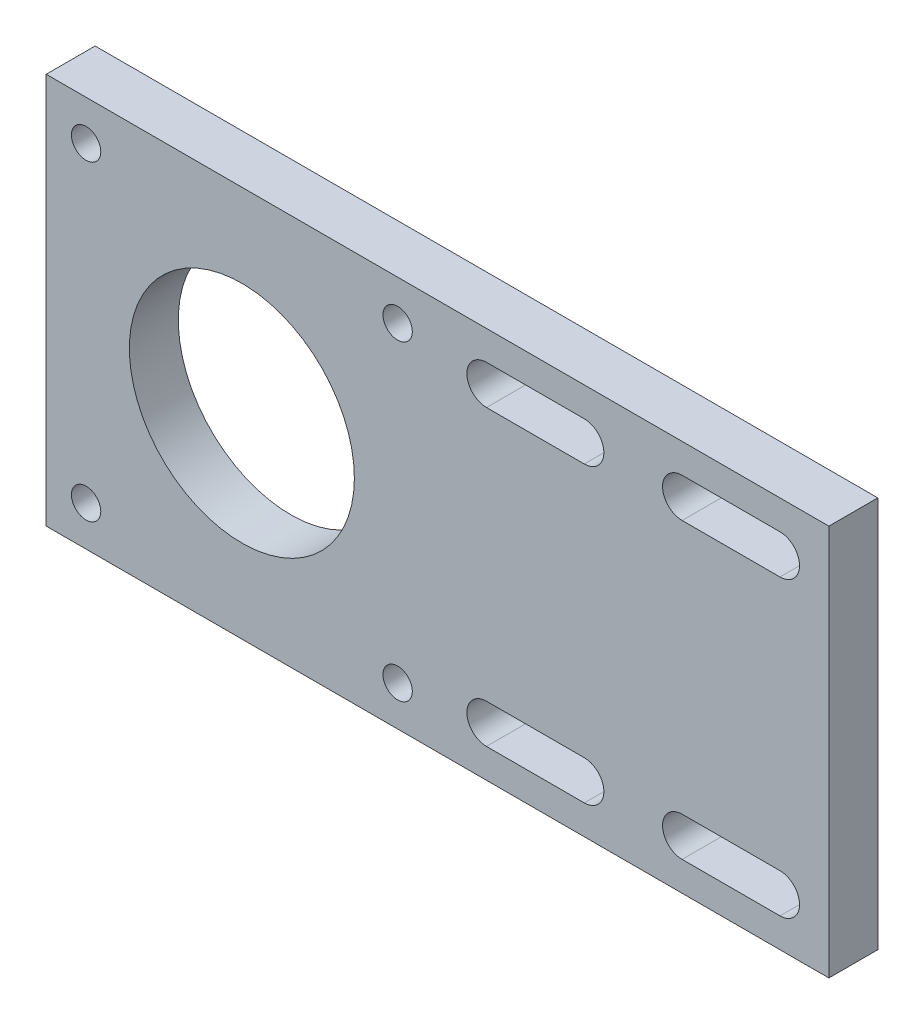
from build123d import *

# Parameters (mm, degrees)
SKETCH1_W           = 80
SKETCH1_H           = 40
SKETCH1_R           = 1.5
SKETCH1_R_2         = 11.5
BOSS_EXTRUDE1_DEPTH = 5


with BuildPart() as part:
    # Sketch1 → Boss-Extrude1 (new body)
    with BuildSketch(Plane.XY):
        with Locations((20, 0)):
            Rectangle(SKETCH1_W, SKETCH1_H)
        with Locations((-15.922, 15.922)):
            Circle(SKETCH1_R, mode=Mode.SUBTRACT)
        with Locations((15.922, 15.922)):
            Circle(SKETCH1_R, mode=Mode.SUBTRACT)
        with Locations((15.922, -15.922)):
            Circle(SKETCH1_R, mode=Mode.SUBTRACT)
        with Locations((-15.922, -15.922)):
            Circle(SKETCH1_R, mode=Mode.SUBTRACT)
        Circle(SKETCH1_R_2, mode=Mode.SUBTRACT)
        with BuildLine():
            Line((25, 17), (35, 17))
            ThreePointArc((35, 17), (37, 15), (35, 13))
            Line((35, 13), (25, 13))
            ThreePointArc((25, 13), (23, 15), (25, 17))
        make_face(mode=Mode.SUBTRACT)
        with BuildLine():
            Line((45, 17), (55, 17))
            ThreePointArc((55, 17), (57, 15), (55, 13))
            Line((55, 13), (45, 13))
            ThreePointArc((45, 13), (43, 15), (45, 17))
        make_face(mode=Mode.SUBTRACT)
        with BuildLine():
            Line((45, -13), (55, -13))
            ThreePointArc((55, -13), (57, -15), (55, -17))
            Line((55, -17), (45, -17))
            ThreePointArc((45, -17), (43, -15), (45, -13))
        make_face(mode=Mode.SUBTRACT)
        with BuildLine():
            Line((25, -13), (35, -13))
            ThreePointArc((35, -13), (37, -15), (35, -17))
            Line((35, -17), (25, -17))
            ThreePointArc((25, -17), (23, -15), (25, -13))
        make_face(mode=Mode.SUBTRACT)
    extrude(amount=BOSS_EXTRUDE1_DEPTH)


solid = part.part
